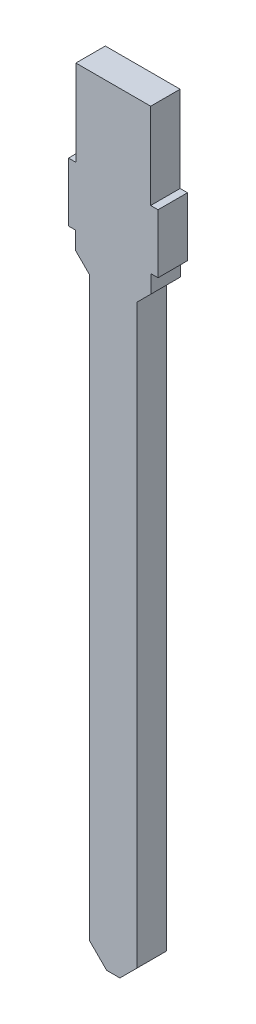
from build123d import *

# Parameters (mm, degrees)
BOSS_EXTRUDE1_DEPTH = 0.5


with BuildPart() as part:
    # Sketch1 → Boss-Extrude1 (new body)
    with BuildSketch(Plane.XY):
        Polygon((-0.635, 13.08), (0.635, 13.08), (0.635, 11.62), (0.76, 11.62), (0.76, 10.62), (0.643038214, 10.62), (0.643038214, 10.323038214), (0.4, 10.08), (0.4, 0.287838255), (0.112161745, 0), (-0.112161745, 0), (-0.4, 0.287838255), (-0.4, 10.08), (-0.643038214, 10.323038214), (-0.643038214, 10.62), (-0.76, 10.62), (-0.76, 11.62), (-0.635, 11.62), align=None)
    extrude(amount=BOSS_EXTRUDE1_DEPTH)


solid = part.part
